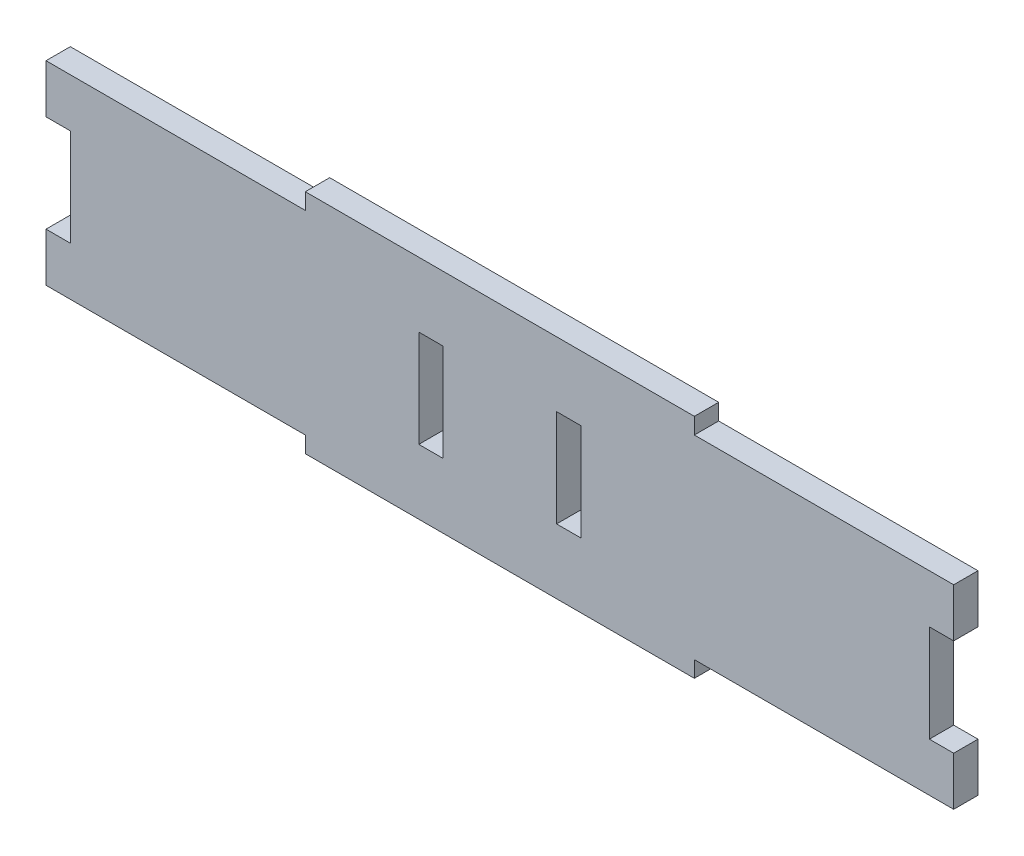
from build123d import *

# Parameters (mm, degrees)
BOSS_EXTRUDE1_DEPTH = 9.525
SKETCH2_W           = 9.525
SKETCH2_H           = 38.1
CUT_EXTRUDE1_DEPTH  = 184.519394411


with BuildPart() as part:
    # Sketch1 → Boss-Extrude1 (new body)
    with BuildSketch(Plane.XY):
        Polygon((-76.2, -38.1), (-76.2, -44.45), (76.2, -44.45), (76.2, -38.1), (177.8, -38.1), (177.8, -19.05), (168.275, -19.05), (168.275, 19.05), (177.8, 19.05), (177.8, 38.1), (76.2, 38.1), (76.2, 44.45), (-76.2, 44.45), (-76.2, 38.1), (-177.8, 38.1), (-177.8, 19.05), (-168.275, 19.05), (-168.275, -19.05), (-177.8, -19.05), (-177.8, -38.1), align=None)
    extrude(amount=BOSS_EXTRUDE1_DEPTH)

    # Sketch2 → Cut-Extrude1 (cut, through all)
    with BuildSketch(Plane.XY.offset(9.525)):
        with Locations((-26.9875, 0)):
            Rectangle(SKETCH2_W, SKETCH2_H)
        with Locations((26.9875, 0)):
            Rectangle(SKETCH2_W, SKETCH2_H)
    extrude(amount=-CUT_EXTRUDE1_DEPTH, mode=Mode.SUBTRACT)


solid = part.part
